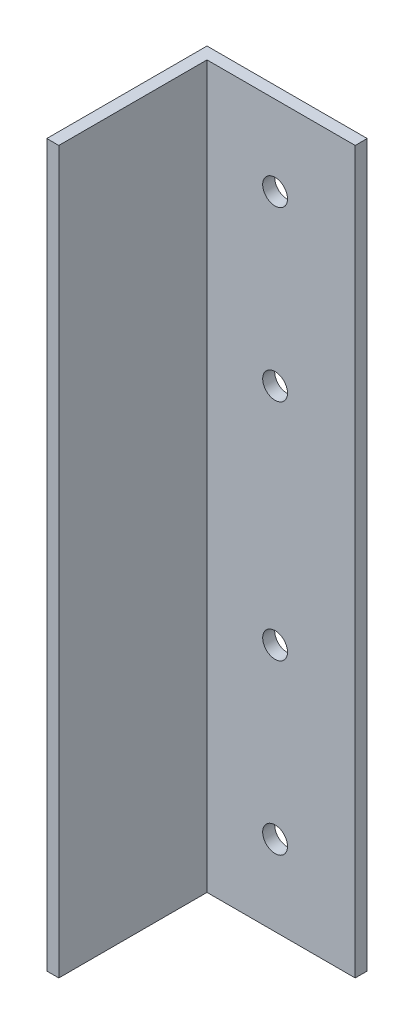
from build123d import *

# Parameters (mm, degrees)
SKETCH1_W           = 20
SKETCH1_H           = 90
BOSS_EXTRUDE1_DEPTH = 1.5
SKETCH2_W           = 1.5
SKETCH2_H           = 90
BOSS_EXTRUDE2_DEPTH = 18.5
SKETCH4_R           = 1.55
CUT_EXTRUDE1_DEPTH  = 18.5


with BuildPart() as part:
    # Sketch1 → Boss-Extrude1 (new body)
    with BuildSketch(Plane.XY):
        with Locations((-18, -24.5)):
            Rectangle(SKETCH1_W, SKETCH1_H)
    extrude(amount=BOSS_EXTRUDE1_DEPTH)

    # Sketch2 → Boss-Extrude2 (add)
    with BuildSketch(Plane.XY.offset(1.5)):
        with Locations((-27.25, -24.5)):
            Rectangle(SKETCH2_W, SKETCH2_H)
    extrude(amount=BOSS_EXTRUDE2_DEPTH)

    # Sketch4 → Cut-Extrude1 (cut)
    with BuildSketch(Plane(origin=(0, 0, 0), x_dir=(-1, 0, 0), z_dir=(0, 0, -1))):
        with Locations((18, 10.5)):
            Circle(SKETCH4_R)
        with Locations((18, -10.5)):
            Circle(SKETCH4_R)
        with Locations((18, -59.5)):
            Circle(SKETCH4_R)
        with Locations((18, -38.5)):
            Circle(SKETCH4_R)
    extrude(amount=-CUT_EXTRUDE1_DEPTH, mode=Mode.SUBTRACT)


solid = part.part
